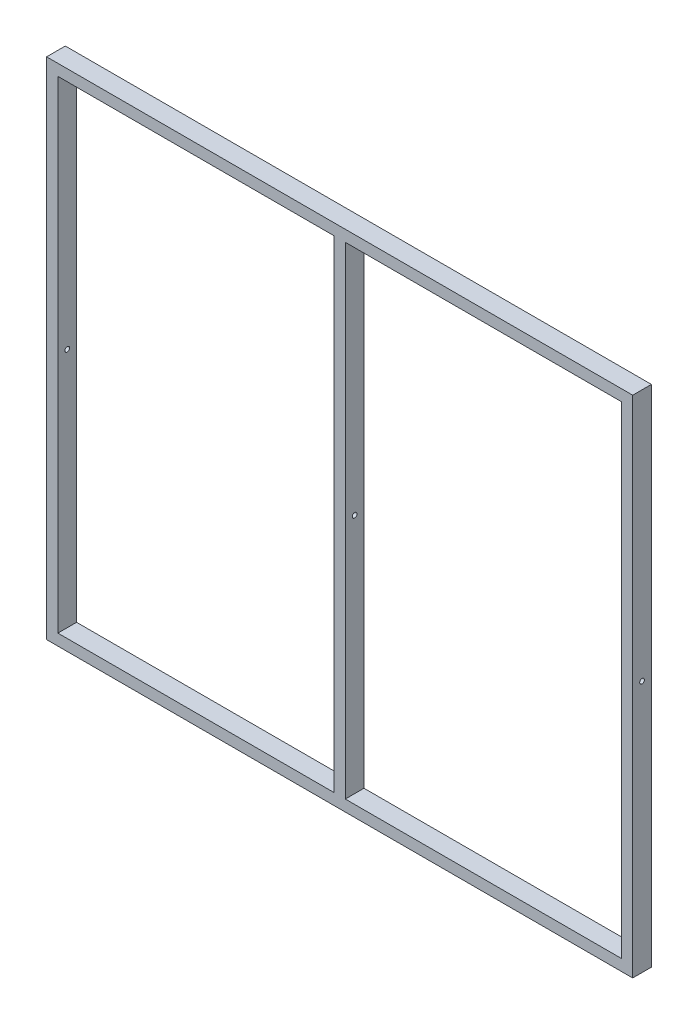
from build123d import *

# Parameters (mm, degrees)
ESQUISSE1_W             = 1974
ESQUISSE1_H             = 1700
ESQUISSE1_W_2           = 930
ESQUISSE1_H_2           = 1624
BOSS_EXTRU_1_DEPTH      = 63
ESQUISSE2_R             = 8
ENL_V_MAT_EXTRU_1_DEPTH = 2606.886605361


with BuildPart() as part:
    # Esquisse1 → Boss.-Extru.1 (new body)
    with BuildSketch(Plane.XY):
        with Locations((987, 850)):
            Rectangle(ESQUISSE1_W, ESQUISSE1_H)
        with Locations((1471, 850)):
            Rectangle(ESQUISSE1_W_2, ESQUISSE1_H_2, mode=Mode.SUBTRACT)
        with Locations((503, 850)):
            Rectangle(ESQUISSE1_W_2, ESQUISSE1_H_2, mode=Mode.SUBTRACT)
    extrude(amount=BOSS_EXTRU_1_DEPTH)

    # Esquisse2 → Enlèv. mat.-Extru.1 (cut, through all)
    with BuildSketch(Plane(origin=(1974, 0, 0), x_dir=(0, 0, -1), z_dir=(1, 0, 0))):
        with Locations((-31.5, 850)):
            Circle(ESQUISSE2_R)
    extrude(amount=-ENL_V_MAT_EXTRU_1_DEPTH, mode=Mode.SUBTRACT)


solid = part.part
